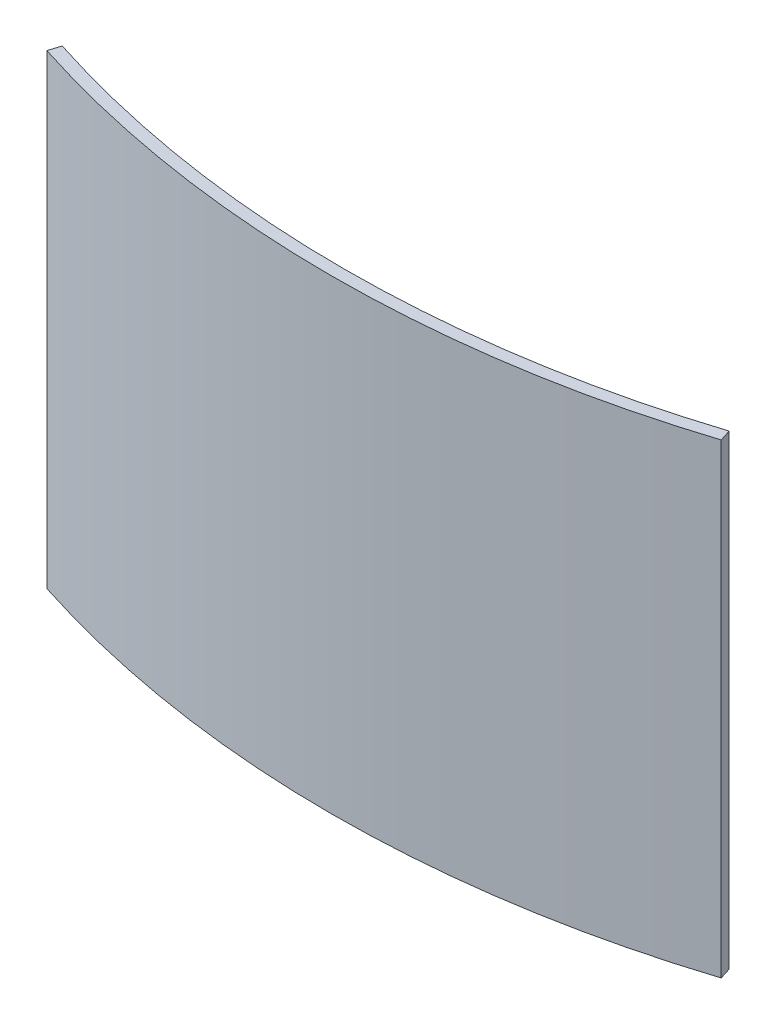
from build123d import *

# Parameters (mm, degrees)
EXTRUS_O_FINA1_DEPTH      = 190
EXTRUS_O_FINA1_DEPTH_BACK = 190


with BuildPart() as part:
    # Esboço1 → Extrusão-Fina1 (new, two sides: drawn at the far end of the back side and taken through both)
    with BuildSketch(Plane(origin=(0, 0, 0), x_dir=(1, 0, 0), z_dir=(0, 1, 0)).offset(-EXTRUS_O_FINA1_DEPTH_BACK)):
        with BuildLine():
            ThreePointArc((275, 0), (0, -43.04317495), (-275, 0))
            Line((-275, 0), (-271.944444444, 9.521742501))
            ThreePointArc((-271.944444444, 9.521742501), (0, -33.04317495), (271.944444444, 9.521742501))
            Line((271.944444444, 9.521742501), (275, 0))
        make_face()
    extrude(amount=EXTRUS_O_FINA1_DEPTH + EXTRUS_O_FINA1_DEPTH_BACK)


solid = part.part
